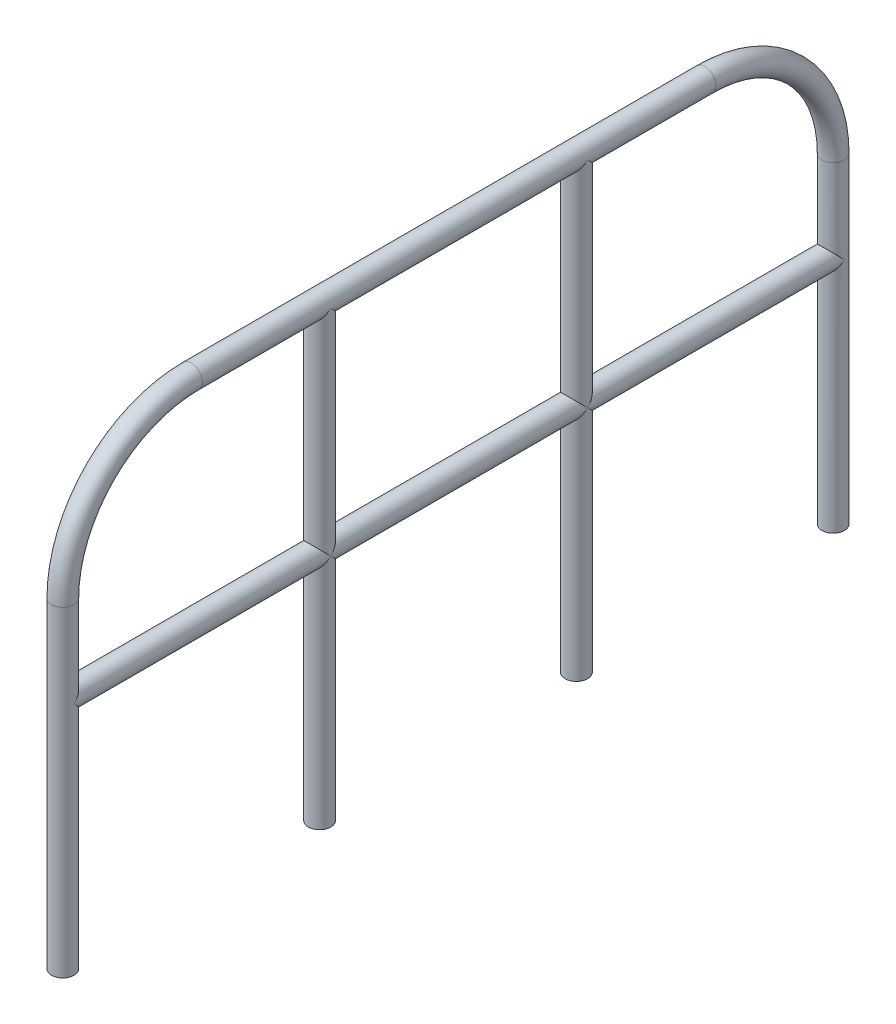
from build123d import *

# Parameters (mm, degrees)
SKETCH_2_R      = 35
SKETCH_3_R      = 35
EXTRUDE_1_DEPTH = 1400
SKETCH_4_R      = 35
EXTRUDE_2_DEPTH = 2400
SKETCH_5_W      = 8.243400837
SKETCH_5_H      = 21.558129969
EXTRUDE_3_DEPTH = 10


with BuildPart() as part:
    # 扫描1: sweep along a path in 草图1
    with BuildLine(Plane(origin=(0, 0, 0), x_dir=(0, 0, -1), z_dir=(1, 0, 0))) as sweep_1_path:
        Line((0, 0), (0, 1000))
        ThreePointArc((0, 1000), (117.157287525, 1282.842712475), (400, 1400))
        Line((400, 1400), (2000, 1400))
        ThreePointArc((2000, 1400), (2282.842712475, 1282.842712475), (2400, 1000))
        Line((2400, 1000), (2400, 0))
    # 草图2 → 扫描1 (sweep)
    with BuildSketch(Plane(origin=(0, 0, 0), x_dir=(1, 0, 0), z_dir=(0, 1, 0))):
        Circle(SKETCH_2_R)
    sweep(path=sweep_1_path.line)

    # 草图3 → 凸台-拉伸1 (add)
    with BuildSketch(Plane(origin=(0, 0, 0), x_dir=(1, 0, 0), z_dir=(0, 1, 0))):
        with Locations(Location((0, 1600, 0), (0, 0, 180))):
            Circle(SKETCH_3_R)
        with Locations(Location((0, 800, 0), (0, 0, 180))):
            Circle(SKETCH_3_R)
    extrude(amount=EXTRUDE_1_DEPTH)

    # 草图4 → 凸台-拉伸2 (add)
    with BuildSketch(Plane.XY):
        with Locations((0, 731.105097609)):
            Circle(SKETCH_4_R)
    extrude(amount=-EXTRUDE_2_DEPTH)


with BuildPart() as body_2:
    # 草图5 → 凸台-拉伸3 (new body)
    with BuildSketch(Plane.XZ):
        with Locations((-39.121700418, -10.779064985)):
            Rectangle(SKETCH_5_W, SKETCH_5_H)
    extrude(amount=-EXTRUDE_3_DEPTH)


solid = Compound([part.part, body_2.part])
